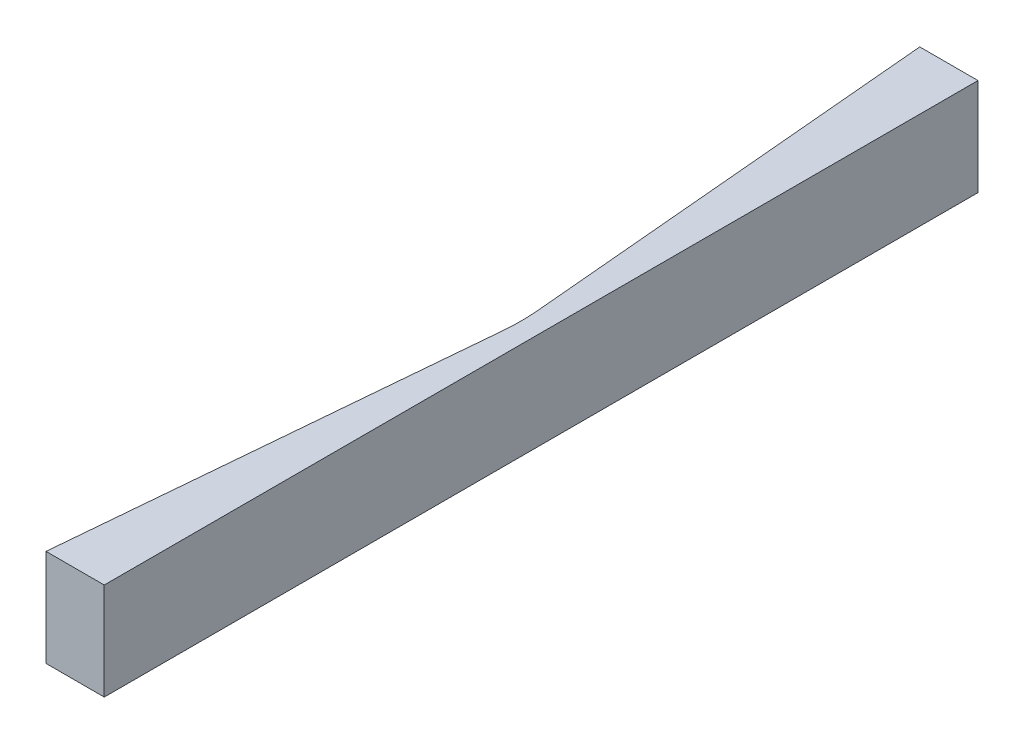
from build123d import *

# Parameters (mm, degrees)
SALIENTE_EXTRUIR1_DEPTH = 5
REDONDEO1_R             = 10


with BuildPart() as part:
    # Croquis1 → Saliente-Extruir1 (new body)
    with BuildSketch(Plane(origin=(0, 0, 0), x_dir=(1, 0, 0), z_dir=(0, 1, 0))):
        Polygon((0, 0), (-3, 0), (-1, 22.5), (-3, 45), (0, 45), align=None)
    extrude(amount=SALIENTE_EXTRUIR1_DEPTH)

    # Redondeo1
    redondeo1_edges = [part.edges().sort_by_distance(p)[0] for p in [
        (-1, 2.5, -22.5),
    ]]
    fillet(redondeo1_edges, radius=REDONDEO1_R)


solid = part.part
